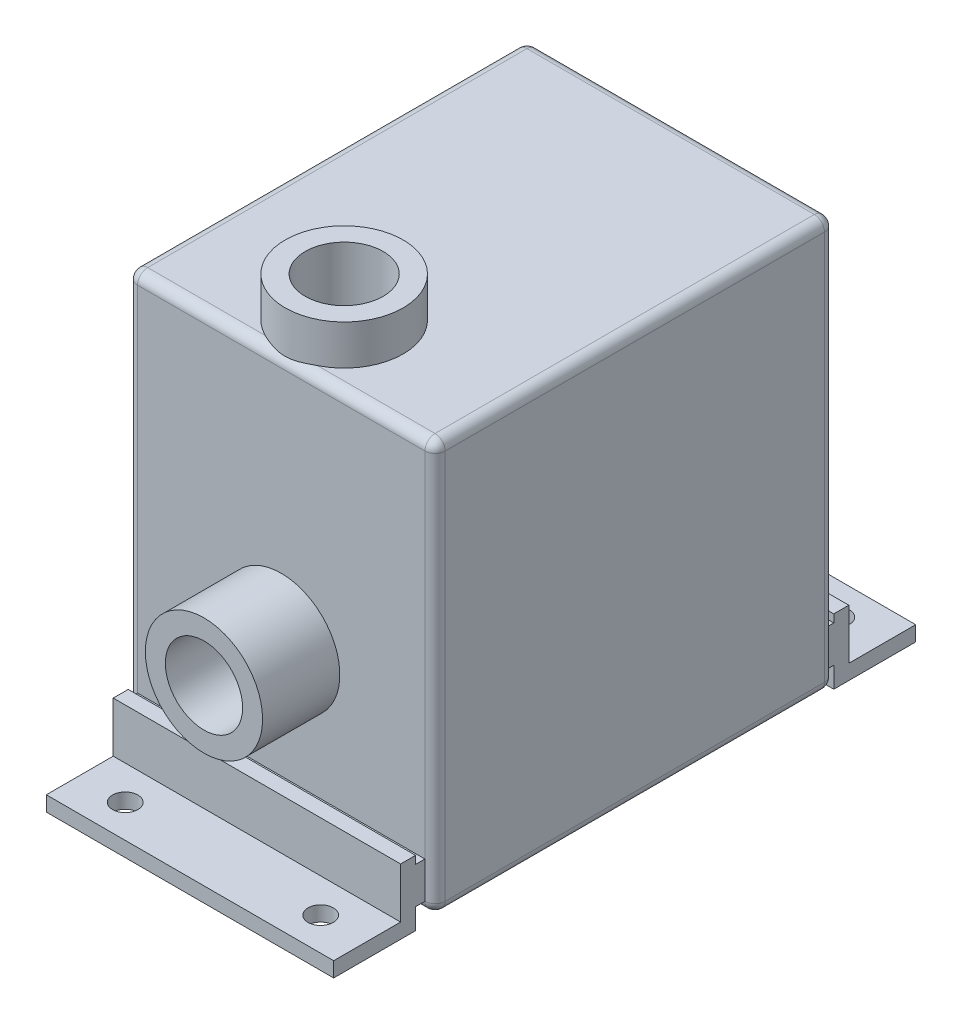
from build123d import *

# Parameters (mm, degrees)
SKETCH1_W                = 46.2
SKETCH1_H                = 60
BOSS_EXTRUDE1_DEPTH      = 30.8
FILLET1_R                = 1.524
BOSS_EXTRUDE2_DEPTH      = 6
BOSS_EXTRUDE2_DEPTH_BACK = 12.07
SKETCH2_R                = 8.849999953
SKETCH3_R                = 5.849999953
CUT_EXTRUDE1_DEPTH       = 35.464
SKETCH4_R                = 8.8
BOSS_EXTRUDE3_DEPTH      = 11.6
SKETCH5_R                = 5.8
CUT_EXTRUDE2_DEPTH       = 59.86
SKETCH6_W                = 43.152
SKETCH6_H                = 5.5
BOSS_EXTRUDE4_DEPTH      = 1.4
BOSS_EXTRUDE5_DEPTH      = 43.152
SKETCH9_R                = 1.9
CUT_EXTRUDE3_DEPTH       = 14.1


with BuildPart() as part:
    # Sketch1 → Boss-Extrude1 (new, symmetric)
    with BuildSketch(Plane(origin=(0, 0, 0), x_dir=(1, 0, 0), z_dir=(0, 1, 0))):
        Rectangle(SKETCH1_W, SKETCH1_H)
    extrude(amount=BOSS_EXTRUDE1_DEPTH, both=True)

    # Fillet1
    fillet1_edges = [part.edges().sort_by_distance(p)[0] for p in [
        (-23.1, 30.8, 0),
        (0, 30.8, 30),
        (23.1, 30.8, 0),
        (0, -30.8, 30),
        (-23.1, -30.8, 0),
        (0, -30.8, -30),
        (23.1, -30.8, 0),
        (0, 30.8, -30),
        (23.1, 0, 30),
        (-23.1, 0, 30),
        (-23.1, 0, -30),
        (23.1, 0, -30),
    ]]
    fillet(fillet1_edges, radius=FILLET1_R)

    # Sketch2 → Boss-Extrude2 (add, two sides: drawn at the far end of the back side and taken through both)
    with BuildSketch(Plane(origin=(0, 30.8, 0), x_dir=(1, 0, 0), z_dir=(0, 1, 0)).offset(-BOSS_EXTRUDE2_DEPTH_BACK)):
        with Locations(Location((0, -20.545484859, 0), (0, 0, 270))):
            Circle(SKETCH2_R)
    extrude(amount=BOSS_EXTRUDE2_DEPTH + BOSS_EXTRUDE2_DEPTH_BACK)

    # Sketch3 → Cut-Extrude1 (cut)
    with BuildSketch(Plane(origin=(0, 36.8, 0), x_dir=(1, 0, 0), z_dir=(0, 1, 0))):
        with Locations(Location((0, -20.545484859, 0), (0, 0, 270))):
            Circle(SKETCH3_R)
    extrude(amount=-CUT_EXTRUDE1_DEPTH, mode=Mode.SUBTRACT)

    # Sketch4 → Boss-Extrude3 (add)
    with BuildSketch(Plane.XY.offset(30)):
        with Locations(Location((0, -6.2, 0), (0, 0, 180))):
            Circle(SKETCH4_R)
    extrude(amount=BOSS_EXTRUDE3_DEPTH)

    # Sketch5 → Cut-Extrude2 (cut)
    with BuildSketch(Plane.XY.offset(41.6)):
        with Locations((0, -6.2)):
            Circle(SKETCH5_R)
    extrude(amount=-CUT_EXTRUDE2_DEPTH, mode=Mode.SUBTRACT)

    # Sketch6 → Boss-Extrude4 (add)
    with BuildSketch(Plane.XY.offset(30)):
        with Locations((0, -26.526)):
            Rectangle(SKETCH6_W, SKETCH6_H)
    boss_extrude4 = extrude(amount=BOSS_EXTRUDE4_DEPTH)

    # Sketch8 → Boss-Extrude5 (add)
    with BuildSketch(Plane.ZY.offset(21.576)):
        Polygon((31.4, -32.4), (31.4, -22.595531019), (33.65, -22.595531019), (33.65, -30.15), (43.7, -30.15), (43.7, -32.4), align=None)
    boss_extrude5 = extrude(amount=-BOSS_EXTRUDE5_DEPTH)

    # Mirror1: Boss-Extrude4, Boss-Extrude5 across plane
    add(boss_extrude4.mirror(Plane.XY))
    add(boss_extrude5.mirror(Plane.XY))

    # Sketch9 → Cut-Extrude3 (cut)
    with BuildSketch(Plane.XZ.offset(32.4)):
        with Locations(Location((-14.675, 38.75, 0), (0, 0, 270))):
            Circle(SKETCH9_R)
        with Locations(Location((14.675, 38.75, 0), (0, 0, 270))):
            Circle(SKETCH9_R)
        with Locations(Location((14.675, -38.75, 0), (0, 0, 270))):
            Circle(SKETCH9_R)
        with Locations(Location((-14.675, -38.75, 0), (0, 0, 270))):
            Circle(SKETCH9_R)
    extrude(amount=-CUT_EXTRUDE3_DEPTH, mode=Mode.SUBTRACT)


solid = part.part
